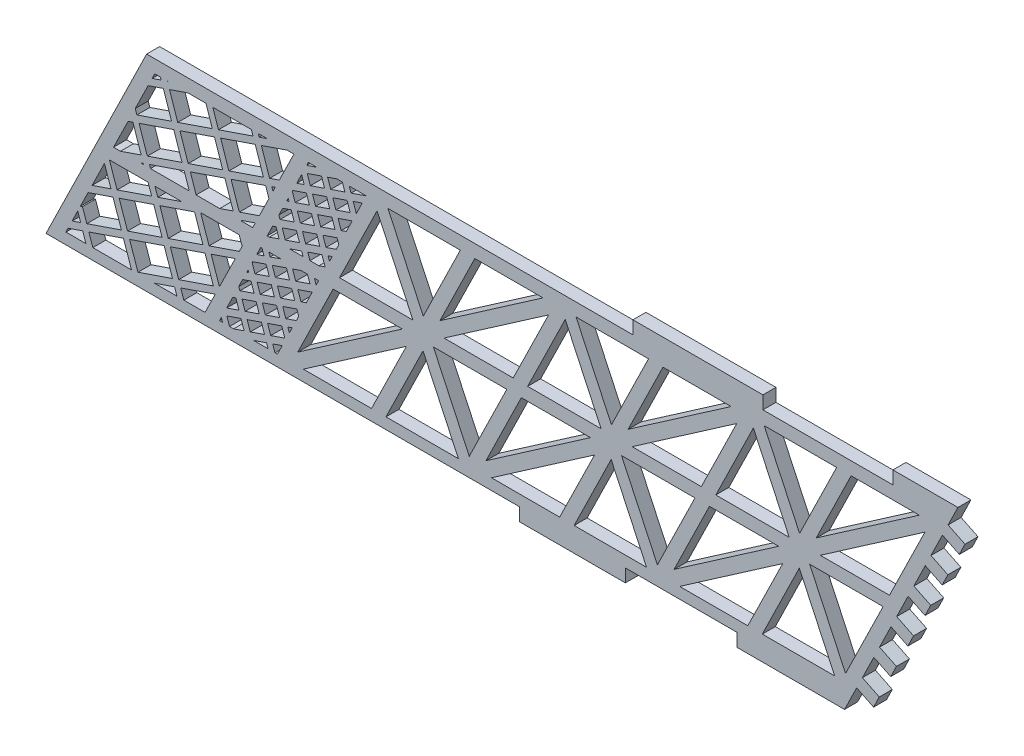
from build123d import *

# Parameters (mm, degrees)
BOSS_EXTRUDE1_DEPTH = 3


with BuildPart() as part:
    # Sketch1 → Boss-Extrude1 (new body)
    with BuildSketch(Plane.XY):
        Polygon((211.572492594, 292.56379709), (215.47170357, 290.655460655), (214.152926827, 287.96086831), (210.253715851, 289.869204745), (207.616162366, 284.480020056), (211.515373342, 282.571683621), (210.196596599, 279.877091277), (206.297385624, 281.785427712), (203.659832139, 276.396243023), (207.559043114, 274.487906587), (206.240266372, 271.793314243), (202.341055396, 273.701650678), (199.703501911, 268.312465989), (203.602712887, 266.404129554), (202.283936144, 263.709537209), (198.384725169, 265.617873644), (195.747171684, 260.228688955), (199.646382659, 258.32035252), (198.327605917, 255.625760175), (194.428394941, 257.534096611), (191.790841456, 252.144911921), (195.690052432, 250.236575486), (194.371275689, 247.541983142), (190.472064714, 249.450319577), (187.676148686, 243.73756041), (162.894396837, 243.73756041), (162.894396837, 246.73756041), (137.094396837, 246.73756041), (137.094396837, 243.73756041), (112.644396837, 243.73756041), (112.644396837, 246.73756041), (3.390990636, 246.73756041), (26.617269187, 294.194685152), (138.838923539, 294.194685152), (138.838923539, 297.194685152), (168.838923539, 297.194685152), (168.838923539, 294.194685152), (198.838923539, 294.194685152), (198.838923539, 297.194685152), (213.838923539, 297.194685152), align=None)
        Polygon((51.171544434, 290.085886357), (43.194658015, 287.351344741), (41.877129627, 291.194685152), (50.791439178, 291.194685152), align=None, mode=Mode.SUBTRACT)
        Polygon((51.657968705, 288.666946109), (43.681082286, 285.932404492), (45.602335319, 280.327948838), (53.579221737, 283.062490455), align=None, mode=Mode.SUBTRACT)
        Polygon((55.484586257, 282.129974477), (56.302151858, 282.410242623), (55.764854402, 281.312408876), align=None, mode=Mode.SUBTRACT)
        Polygon((54.998161986, 283.548914726), (57.234667835, 284.315607142), (60.601399025, 291.194685152), (59.031594735, 291.194685152), (53.076908953, 289.15337038), align=None, mode=Mode.SUBTRACT)
        Polygon((52.590484682, 290.572310628), (54.40600318, 291.194685152), (52.377129627, 291.194685152), align=None, mode=Mode.SUBTRACT)
        Polygon((46.08875959, 278.90900859), (48.010012622, 273.304552936), (52.618949237, 274.884533936), (54.832338424, 279.407044357), (54.065646008, 281.643550206), align=None, mode=Mode.SUBTRACT)
        Polygon((22.198688532, 256.607453582), (30.175574951, 259.341995198), (28.254321918, 264.946450852), (20.2774355, 262.211909236), align=None, mode=Mode.SUBTRACT)
        Polygon((19.791011229, 263.630849484), (27.767897647, 266.3653911), (26.950858797, 268.748761706), (18.036549246, 268.748761706), align=None, mode=Mode.SUBTRACT)
        Polygon((18.37207098, 263.144425213), (14.032766072, 261.656876158), (16.884521925, 267.483730121), align=None, mode=Mode.SUBTRACT)
        Polygon((18.858495251, 261.725484965), (20.779748284, 256.121029311), (12.802861865, 253.386487694), (11.803407258, 256.301980307), (11.333085478, 256.140750171), (13.100250094, 259.751511638), align=None, mode=Mode.SUBTRACT)
        Polygon((13.289286136, 251.967547446), (14.202770142, 249.302838261), (23.117079693, 249.302838261), (21.266172555, 254.702089062), align=None, mode=Mode.SUBTRACT)
        Polygon((24.606365836, 249.584057679), (32.583252254, 252.318599296), (30.661999222, 257.92305495), (22.685112803, 255.188513333), align=None, mode=Mode.SUBTRACT)
        Polygon((25.846644615, 271.969846754), (25.201721054, 271.748761706), (25.922434369, 271.748761706), align=None, mode=Mode.SUBTRACT)
        Polygon((23.438967311, 278.993242657), (22.331687292, 278.61365805), (18.971896838, 271.748761706), (20.576129499, 271.748761706), (25.360220344, 273.388787003), align=None, mode=Mode.SUBTRACT)
        Polygon((26.779160592, 273.875211274), (34.787568403, 276.62055868), (32.866315371, 282.225014334), (24.857907559, 279.479666928), align=None, mode=Mode.SUBTRACT)
        Polygon((27.508124818, 271.748761706), (36.457660075, 271.748761706), (35.273992674, 275.201618432), (27.265584863, 272.456271025), align=None, mode=Mode.SUBTRACT)
        Polygon((29.186837896, 266.851815371), (34.720388882, 268.748761706), (28.536549246, 268.748761706), align=None, mode=Mode.SUBTRACT)
        Polygon((31.594515199, 259.828419469), (39.60292301, 262.573766875), (37.681669978, 268.178222529), (29.673262167, 265.432875123), align=None, mode=Mode.SUBTRACT)
        Polygon((34.002192503, 252.805023567), (42.010600314, 255.550370973), (40.089347281, 261.154826627), (32.08093947, 258.409479221), align=None, mode=Mode.SUBTRACT)
        Polygon((24.371483288, 280.898607176), (32.3798911, 283.643954583), (30.458638067, 289.248410236), (26.947405891, 288.044731256), (23.991898682, 282.005887195), align=None, mode=Mode.SUBTRACT)
        Polygon((44.669819341, 278.422584319), (36.692932923, 275.688042703), (38.043350524, 271.748761706), (43.471639589, 271.748761706), (46.591072374, 272.818128665), align=None, mode=Mode.SUBTRACT)
        Polygon((42.262142038, 285.445980221), (34.285255619, 282.711438605), (36.206508652, 277.106982951), (44.18339507, 279.841524568), align=None, mode=Mode.SUBTRACT)
        Polygon((41.775717767, 286.86492047), (33.798831348, 284.130378854), (31.877578315, 289.734834507), (36.136084645, 291.194685152), (40.291439178, 291.194685152), align=None, mode=Mode.SUBTRACT)
        Polygon((48.543350524, 271.748761706), (51.084251977, 271.748761706), (51.686433259, 272.979169416), (48.496436893, 271.885612688), align=None, mode=Mode.SUBTRACT)
        Polygon((49.571774951, 268.748761707), (49.616003826, 268.748761707), (49.589993622, 268.695616322), align=None, mode=Mode.SUBTRACT)
        Polygon((29.972213796, 290.667350485), (27.879921868, 289.950095776), (28.489043885, 291.194685152), (29.791439178, 291.194685152), align=None, mode=Mode.SUBTRACT)
        Polygon((31.391154044, 291.153774756), (31.510493089, 291.194685152), (31.377129627, 291.194685152), align=None, mode=Mode.SUBTRACT)
        Polygon((39.345980437, 268.748761706), (39.100610226, 268.6646468), (41.021863259, 263.060191146), (48.003230638, 265.45346073), (48.657477645, 266.790251802), (47.986084502, 268.748761706), align=None, mode=Mode.SUBTRACT)
        Polygon((41.50828753, 261.641250898), (47.07071466, 263.548096211), (43.415132842, 256.078823767), align=None, mode=Mode.SUBTRACT)
        Polygon((33.069676525, 250.899659047), (33.617079693, 249.302838261), (28.411616846, 249.302838261), align=None, mode=Mode.SUBTRACT)
        Polygon((40.098856779, 249.302838261), (42.454996062, 254.117023005), (34.488616774, 251.386083318), (35.202770142, 249.302838261), align=None, mode=Mode.SUBTRACT)
        Polygon((9.417047473, 252.225802952), (11.383921617, 252.900063423), (10.709661145, 254.866937567), align=None, mode=Mode.SUBTRACT)
        Polygon((11.870345888, 251.481123175), (12.617079693, 249.302838261), (7.986501639, 249.302838261), (8.484531496, 250.320438432), align=None, mode=Mode.SUBTRACT)
        Polygon((70.782164909, 283.449725357), (71.49957929, 281.356967654), (72.685794672, 281.763611946), (74.061137994, 284.57378403), align=None, mode=Mode.SUBTRACT)
        Polygon((72.857299342, 288.085481981), (69.578326257, 286.961423308), (70.295740638, 284.868665606), (73.574713723, 285.992724278), align=None, mode=Mode.SUBTRACT)
        Polygon((72.370875071, 289.504422229), (69.091901986, 288.380363557), (68.374487605, 290.47312126), (70.479349781, 291.194685152), (71.791439178, 291.194685152), align=None, mode=Mode.SUBTRACT)
        Polygon((73.78981532, 289.9908465), (77.301513271, 291.194685152), (73.377129627, 291.194685152), align=None, mode=Mode.SUBTRACT)
        Polygon((74.993653971, 286.479148549), (76.368997293, 289.289320633), (74.276239591, 288.571906252), align=None, mode=Mode.SUBTRACT)
        Polygon((88.073670381, 271.748761706), (79.794573174, 289.46412698), (71.124389072, 271.748761706), align=None, mode=Mode.SUBTRACT)
        Polygon((70.567063312, 279.451603135), (67.288090227, 278.327544462), (68.005504608, 276.23478676), (70.377935373, 277.048075343), (70.973707604, 278.265387753), align=None, mode=Mode.SUBTRACT)
        Polygon((69.36322466, 282.963301086), (66.084251575, 281.839242413), (66.801665956, 279.746484711), (70.080639041, 280.870543383), align=None, mode=Mode.SUBTRACT)
        Polygon((68.159386009, 286.474999037), (64.880412923, 285.350940365), (65.597827304, 283.258182662), (68.876800389, 284.382241335), align=None, mode=Mode.SUBTRACT)
        Polygon((66.955547357, 289.986696989), (63.676574272, 288.862638316), (64.393988653, 286.769880613), (67.672961738, 287.893939286), align=None, mode=Mode.SUBTRACT)
        Polygon((67.072988631, 274.32942224), (63.794015545, 273.205363567), (64.293350524, 271.748761707), (66.36714968, 271.748761707), (67.790403011, 272.236664537), align=None, mode=Mode.SUBTRACT)
        Polygon((65.869149979, 277.841120191), (62.590176894, 276.717061519), (63.307591275, 274.624303816), (66.58656436, 275.748362489), align=None, mode=Mode.SUBTRACT)
        Polygon((64.665311327, 281.352818142), (61.386338242, 280.22875947), (62.103752623, 278.136001767), (65.382725708, 279.26006044), align=None, mode=Mode.SUBTRACT)
        Polygon((63.461472675, 284.864516094), (60.315520945, 283.786058225), (60.228100394, 283.607436066), (60.899913971, 281.647699718), (64.178887056, 282.771758391), align=None, mode=Mode.SUBTRACT)
        Polygon((62.383014806, 288.010467824), (61.248036923, 285.691422744), (62.975048404, 286.283456342), align=None, mode=Mode.SUBTRACT)
        Polygon((68.818793192, 273.862355995), (69.445419395, 275.142710824), (68.491928879, 274.815846511), align=None, mode=Mode.SUBTRACT)
        Polygon((85.623781693, 268.748761707), (69.656140921, 268.748761707), (61.488102251, 252.059405759), align=None, mode=Mode.SUBTRACT)
        Polygon((64.782752601, 265.695543394), (61.503779516, 264.571484721), (62.221193896, 262.478727019), (63.454357474, 262.901465534), (64.798846824, 265.648595198), align=None, mode=Mode.SUBTRACT)
        Polygon((63.736084502, 268.748761706), (62.241490528, 268.748761706), (60.299940864, 268.083182673), (61.017355245, 265.99042497), (64.29632833, 267.114483643), align=None, mode=Mode.SUBTRACT)
        Polygon((62.375075297, 272.718939296), (59.54498619, 271.748761707), (62.707660075, 271.748761707), align=None, mode=Mode.SUBTRACT)
        Polygon((61.171236645, 276.230637248), (57.89226356, 275.106578575), (58.609677941, 273.013820872), (61.888651026, 274.137879545), align=None, mode=Mode.SUBTRACT)
        Polygon((59.967397993, 279.742335199), (58.007661646, 279.070521622), (57.140670004, 277.299039789), (57.405839289, 276.525518823), (60.684812374, 277.649577496), align=None, mode=Mode.SUBTRACT)
        Polygon((59.295584416, 281.702071547), (58.940177623, 280.975886141), (59.480973722, 281.161275447), align=None, mode=Mode.SUBTRACT)
        Polygon((65.715268578, 267.600907914), (65.762216774, 267.617002137), (66.316118072, 268.748761707), (65.321774951, 268.748761707), align=None, mode=Mode.SUBTRACT)
        Polygon((61.288677919, 260.573362499), (58.009704834, 259.449303826), (58.727119215, 257.356546124), (61.146498175, 258.185928931), (61.711416435, 259.340198921), align=None, mode=Mode.SUBTRACT)
        Polygon((60.084839267, 264.08506045), (56.805866182, 262.961001778), (57.523280563, 260.868244075), (60.802253648, 261.992302748), align=None, mode=Mode.SUBTRACT)
        Polygon((58.881000615, 267.596758402), (55.60202753, 266.472699729), (56.319441911, 264.379942026), (59.598414996, 265.504000699), align=None, mode=Mode.SUBTRACT)
        Polygon((56.473323312, 274.620154304), (55.699802346, 274.354985019), (54.424274827, 271.748761706), (54.919394635, 271.748761706), (57.190737693, 272.527396601), align=None, mode=Mode.SUBTRACT)
        Polygon((57.794603237, 255.451181604), (54.515630152, 254.327122932), (55.233044533, 252.234365229), (58.512017618, 253.358423902), align=None, mode=Mode.SUBTRACT)
        Polygon((56.590764585, 258.962879556), (53.3117915, 257.838820883), (54.029205881, 255.74606318), (57.308178966, 256.870121853), align=None, mode=Mode.SUBTRACT)
        Polygon((55.386925934, 262.474577507), (52.107952849, 261.350518834), (52.825367229, 259.257761131), (56.104340314, 260.381819804), align=None, mode=Mode.SUBTRACT)
        Polygon((54.183087282, 265.986275458), (51.084083747, 264.923911813), (50.965809224, 264.682247235), (51.621528578, 262.769459082), (54.900501663, 263.893517755), align=None, mode=Mode.SUBTRACT)
        Polygon((53.236084502, 268.748761706), (52.956026676, 268.748761706), (52.016599725, 266.829276332), (53.696663011, 267.405215706), align=None, mode=Mode.SUBTRACT)
        Polygon((55.115603259, 267.891639977), (57.615898972, 268.748761707), (54.821774951, 268.748761707), align=None, mode=Mode.SUBTRACT)
        Polygon((59.556502022, 254.937167163), (60.213982198, 256.280564412), (59.213543486, 255.937605875), align=None, mode=Mode.SUBTRACT)
        Polygon((54.300528556, 250.329000709), (51.307126937, 249.302838261), (54.652305399, 249.302838261), align=None, mode=Mode.SUBTRACT)
        Polygon((53.096689904, 253.840698661), (49.817716819, 252.716639988), (50.5351312, 250.623882285), (53.814104285, 251.747940958), align=None, mode=Mode.SUBTRACT)
        Polygon((51.892851252, 257.352396612), (48.613878167, 256.228337939), (49.331292548, 254.135580236), (52.610265633, 255.259638909), align=None, mode=Mode.SUBTRACT)
        Polygon((50.6890126, 260.864094563), (48.776224448, 260.20837521), (47.878378834, 258.373850957), (48.127453896, 257.647278188), (51.406426981, 258.77133686), align=None, mode=Mode.SUBTRACT)
        Polygon((50.033293247, 262.776882715), (49.708740426, 262.113739729), (50.202588329, 262.283034812), align=None, mode=Mode.SUBTRACT)
        Polygon((56.798971025, 249.302838261), (57.906122898, 251.565027809), (55.719468804, 250.81542498), (56.237995848, 249.302838261), align=None, mode=Mode.SUBTRACT)
        Polygon((48.39877657, 252.230215717), (45.119803485, 251.106157044), (45.737995848, 249.302838261), (46.681535382, 249.302838261), (49.116190951, 250.137458014), align=None, mode=Mode.SUBTRACT)
        Polygon((47.194937918, 255.741913668), (46.468365149, 255.492838607), (45.093021827, 252.682666523), (47.912352299, 253.649155965), align=None, mode=Mode.SUBTRACT)
        Polygon((43.858432467, 250.160090161), (44.152305398, 249.302838261), (43.438879628, 249.302838261), align=None, mode=Mode.SUBTRACT)
        Polygon((63.555896222, 290.406959347), (63.941421874, 291.194685152), (65.853758225, 291.194685152), align=None, mode=Mode.SUBTRACT)
        Polygon((181.144388565, 274.750822825), (189.192278717, 291.194685152), (204.925042005, 291.194685152), align=None, mode=Mode.SUBTRACT)
        Polygon((182.077616568, 271.748761707), (198.04525734, 271.748761707), (206.21329601, 288.438117655), align=None, mode=Mode.SUBTRACT)
        Polygon((156.496734999, 268.748761707), (148.328696329, 252.059405759), (172.464375771, 268.748761707), align=None, mode=Mode.SUBTRACT)
        Polygon((165.349713622, 249.302838261), (173.397603774, 265.746700588), (149.616950334, 249.302838261), align=None, mode=Mode.SUBTRACT)
        Polygon((154.624960301, 271.748761707), (162.792998971, 288.438117654), (138.657319529, 271.748761707), align=None, mode=Mode.SUBTRACT)
        Polygon((145.771981678, 291.194685152), (137.724091526, 274.750822825), (161.504744966, 291.194685152), align=None, mode=Mode.SUBTRACT)
        Polygon((113.07643796, 268.748761707), (104.90839929, 252.059405759), (129.044078732, 268.748761707), align=None, mode=Mode.SUBTRACT)
        Polygon((121.929416583, 249.302838261), (129.977306735, 265.746700588), (106.196653295, 249.302838261), align=None, mode=Mode.SUBTRACT)
        Polygon((111.204663262, 271.748761707), (119.372701933, 288.438117654), (95.23702249, 271.748761707), align=None, mode=Mode.SUBTRACT)
        Polygon((102.351684639, 291.194685152), (94.303794487, 274.750822825), (118.084447927, 291.194685152), align=None, mode=Mode.SUBTRACT)
        Polygon((98.563546218, 249.302838261), (90.399177977, 266.772709914), (81.849142393, 249.302838261), align=None, mode=Mode.SUBTRACT)
        Polygon((179.62772788, 268.748761707), (196.577009189, 268.748761707), (187.906825087, 251.033396433), align=None, mode=Mode.SUBTRACT)
        Polygon((166.635167252, 289.46412698), (157.96498315, 271.748761707), (174.914264459, 271.748761707), align=None, mode=Mode.SUBTRACT)
        Polygon((177.239772055, 266.772709914), (168.689736471, 249.302838261), (185.404140296, 249.302838261), align=None, mode=Mode.SUBTRACT)
        Polygon((177.302220284, 273.724813499), (185.852255868, 291.194685152), (169.137852043, 291.194685152), align=None, mode=Mode.SUBTRACT)
        Polygon((144.486528048, 251.033396433), (153.15671215, 268.748761707), (136.207430841, 268.748761707), align=None, mode=Mode.SUBTRACT)
        Polygon((133.819475016, 266.772709914), (125.269439432, 249.302838261), (141.983843257, 249.302838261), align=None, mode=Mode.SUBTRACT)
        Polygon((123.214870213, 289.46412698), (114.544686111, 271.748761707), (131.49396742, 271.748761707), align=None, mode=Mode.SUBTRACT)
        Polygon((133.881923245, 273.724813499), (142.431958829, 291.194685152), (125.717555004, 291.194685152), align=None, mode=Mode.SUBTRACT)
        Polygon((101.066231009, 251.033396433), (109.736415111, 268.748761707), (92.787133802, 268.748761707), align=None, mode=Mode.SUBTRACT)
        Polygon((90.461626206, 273.724813499), (99.01166179, 291.194685152), (82.297257966, 291.194685152), align=None, mode=Mode.SUBTRACT)
        Polygon((78.509119544, 249.302838261), (86.557009696, 265.746700588), (62.776356256, 249.302838261), align=None, mode=Mode.SUBTRACT)
    extrude(amount=BOSS_EXTRUDE1_DEPTH)


solid = part.part
